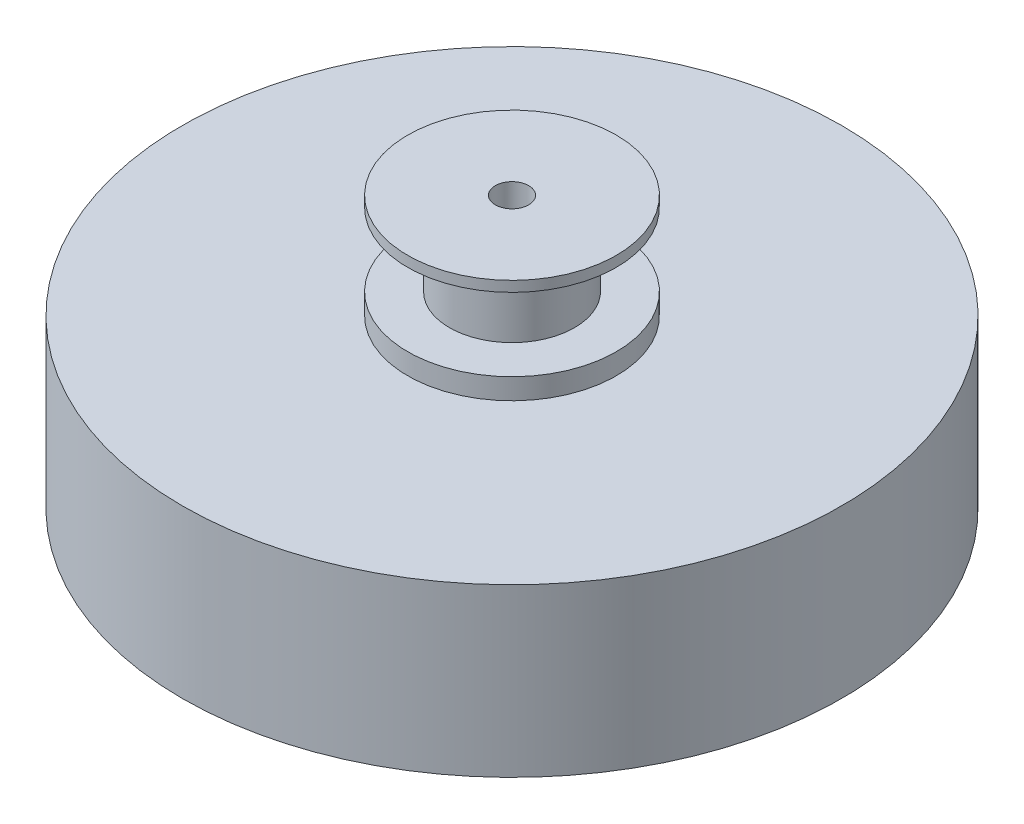
from build123d import *


with BuildPart() as part:
    # Sketch1 → Revolve1 (revolve)
    with BuildSketch(Plane(origin=(0, 0, 0), x_dir=(0, 0, -1), z_dir=(1, 0, 0)), mode=Mode.PRIVATE) as revolve1_sk:
        Polygon((-50, 40), (-158, 40), (-158, -40), (-50, -40), (-50, -50), (-30, -50), (-30, -85), (-50, -85), (-50, -90), (-8, -90), (-8, 90), (-50, 90), (-50, 85), (-30, 85), (-30, 50), (-50, 50), align=None)
    revolve(revolve1_sk.sketch.rotate(Axis((0, -5577.839151729, 0), (0, 1, 0)), 180), axis=Axis((0, -5577.839151729, 0), (0, 1, 0)))


solid = part.part
